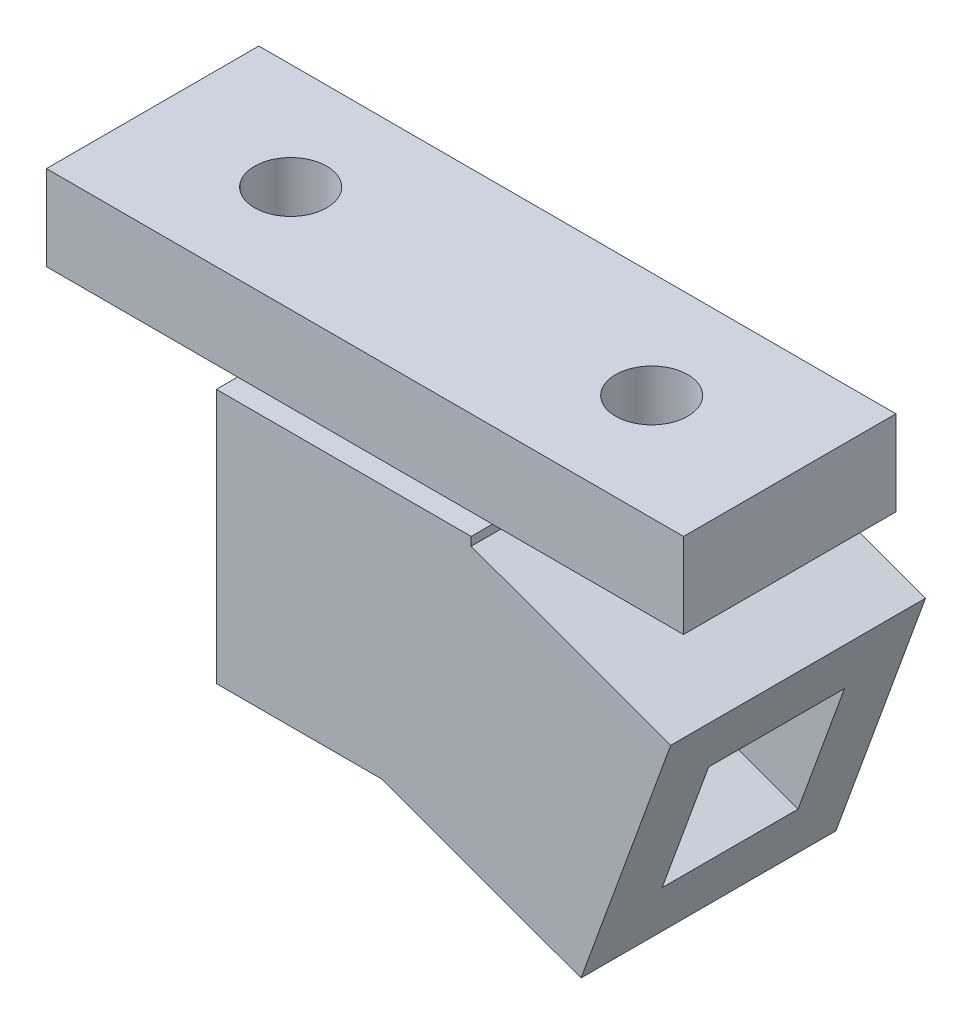
from build123d import *

# Parameters (mm, degrees)
SKETCH_1_W          = 15
SKETCH_1_H          = 5
SKETCH_1_R          = 0.85
EXTRUDE_1_DEPTH     = 2
SKETCH_2_W          = 6
SKETCH_2_H          = 6
EXTRUDE_3_DEPTH     = 6
CUT_EXTRUDE_2_DEPTH = 6
SKETCH_7_W          = 3.2
SKETCH_7_H          = 3.2
CUT_EXTRUDE_3_DEPTH = 2
SKETCH_10_W         = 6
SKETCH_10_H         = 6.172231081
SKETCH_10_W_2       = 3.2
SKETCH_10_H_2       = 3.2
EXTRUDE_4_DEPTH     = 5


with BuildPart() as part:
    # 草图1 → 凸台-拉伸1 (new body)
    with BuildSketch(Plane(origin=(0, 0, 0), x_dir=(1, 0, 0), z_dir=(0, 1, 0))):
        with Locations((7.5, 2.5)):
            Rectangle(SKETCH_1_W, SKETCH_1_H)
        with Locations(Location((3.25, 2.5, 0), (0, 0, 270))):
            Circle(SKETCH_1_R, mode=Mode.SUBTRACT)
        with Locations(Location((11.75, 2.5, 0), (0, 0, 90))):
            Circle(SKETCH_1_R, mode=Mode.SUBTRACT)
    extrude(amount=EXTRUDE_1_DEPTH)

    # 草图2 → 凸台-拉伸3 (add)
    with BuildSketch(Plane.XZ):
        with Locations((7.5, -2.5)):
            Rectangle(SKETCH_2_W, SKETCH_2_H)
    extrude(amount=EXTRUDE_3_DEPTH)

    # 草图6 → 切除-拉伸2 (cut)
    with BuildSketch(Plane(origin=(0, 0, -5.5), x_dir=(-1, 0, 0), z_dir=(0, 0, -1))):
        Polygon((-10.5, -0.2), (-10.5, -6), (-8.388972641, -6), align=None)
    extrude(amount=-CUT_EXTRUDE_2_DEPTH, mode=Mode.SUBTRACT)

    # 草图7 → 切除-拉伸3 (cut)
    with BuildSketch(Plane(origin=(9.336012087, -3.398030507, 0), x_dir=(0, 0, -1), z_dir=(0.9396926207859104, -0.3420201433256631, 0))):
        with Locations((2.5, 0.317157441)):
            Rectangle(SKETCH_7_W, SKETCH_7_H)
    extrude(amount=-CUT_EXTRUDE_3_DEPTH, mode=Mode.SUBTRACT)

    # 草图10 → 凸台-拉伸4 (add)
    with BuildSketch(Plane(origin=(9.336012087, -3.398030507, 0), x_dir=(0, 0, -1), z_dir=(0.9396926207859104, -0.3420201433256631, 0))):
        with Locations((2.5, 0.31715744)):
            Rectangle(SKETCH_10_W, SKETCH_10_H)
        with Locations((2.5, 0.317157441)):
            Rectangle(SKETCH_10_W_2, SKETCH_10_H_2, mode=Mode.SUBTRACT)
    extrude(amount=EXTRUDE_4_DEPTH)


solid = part.part
